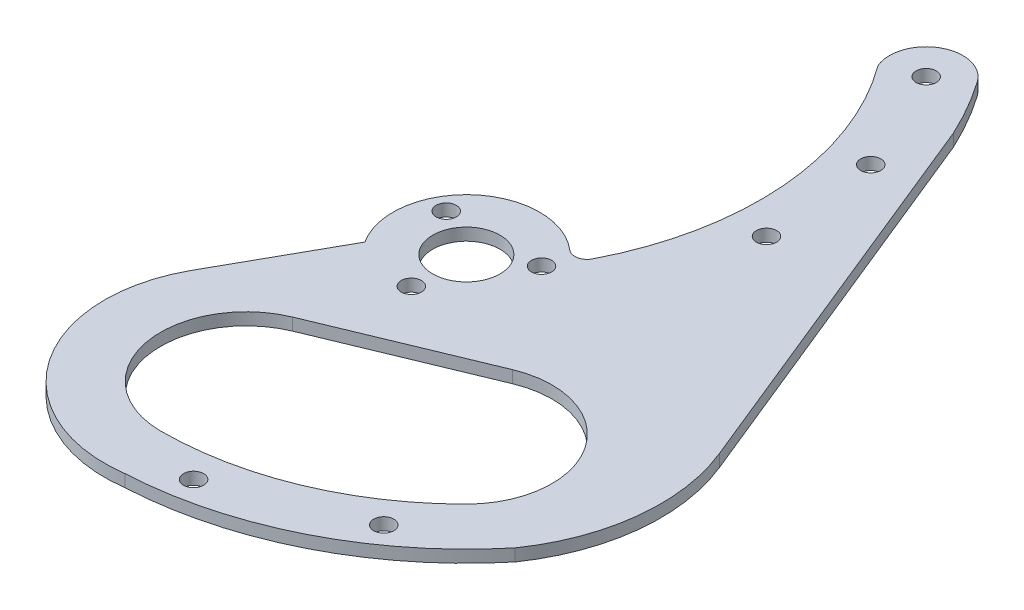
from build123d import *

# Parameters (mm, degrees)
SKETCH_1_R          = 1.65
SKETCH_1_R_2        = 5.5
EXTRUDE_1_DEPTH     = 2
SKETCH_2_R          = 1.65
CUT_EXTRUDE_1_DEPTH = 86.784644099
FILLET_1_R          = 2


with BuildPart() as part:
    # Эскиз1 → Бобышка-Вытянуть1 (new body)
    with BuildSketch(Plane(origin=(0, 0, 0), x_dir=(1, 0, 0), z_dir=(0, 1, 0))):
        with BuildLine():
            Line((22.63058135, 57.022094922), (48.869113703, -7.475462073))
            ThreePointArc((48.869113703, -7.475462073), (51.017863934, -22.940417651), (45.538728547, -37.5609872))
            ThreePointArc((45.538728547, -37.5609872), (26.585605536, -52.704925153), (3.142096023, -58.946847156))
            ThreePointArc((3.142096023, -58.946847156), (-19.13330087, -49.051718647), (-20.218209383, -24.701567755))
            Line((-20.218209383, -24.701567755), (-10.065450366, -6.533506633))
            ThreePointArc((-10.065450366, -6.533506633), (-6.891228037, 9.824000007), (9.569842381, 7.24003569))
            ThreePointArc((9.569842381, 7.24003569), (16.257964509, 34.227304723), (6.907279065, 60.411428714))
            ThreePointArc((6.907279065, 60.411428714), (9.487905153, 68.030832797), (17.329317504, 66.234391334))
            ThreePointArc((17.329317504, 66.234391334), (20.184340604, 61.745861093), (22.63058135, 57.022094922))
        make_face()
        with Locations(Location((9.550649772, -54.164426416, 0), (0, 0, 270))):
            Circle(SKETCH_1_R, mode=Mode.SUBTRACT)
        with Locations(Location((31.546703999, -45.053362436, 0), (0, 0, 90))):
            Circle(SKETCH_1_R, mode=Mode.SUBTRACT)
        with Locations(Location((0, 0, 0), (0, 0, 270))):
            Circle(SKETCH_1_R_2, mode=Mode.SUBTRACT)
        with Locations(Location((0, -9, 0), (0, 0, 270))):
            Circle(SKETCH_1_R, mode=Mode.SUBTRACT)
        with Locations(Location((-7.794228634, 4.5, 0), (0, 0, 270))):
            Circle(SKETCH_1_R, mode=Mode.SUBTRACT)
        with Locations(Location((7.794228634, 4.5, 0), (0, 0, 270))):
            Circle(SKETCH_1_R, mode=Mode.SUBTRACT)
        with BuildLine():
            Line((-5.357568053, -23.065686545), (20.09827607, -12.521530668))
            ThreePointArc((20.09827607, -12.521530668), (37.096418695, -17.67786086), (35.355339059, -35.355339059))
            ThreePointArc((35.355339059, -35.355339059), (19.134171618, -46.193976626), (0, -50))
            ThreePointArc((0, -50), (-13.730993926, -38.731264508), (-5.357568053, -23.065686545))
        make_face(mode=Mode.SUBTRACT)
    extrude(amount=EXTRUDE_1_DEPTH)

    # Эскиз2 → Вырез-Вытянуть1 (cut, through all)
    with BuildSketch(Plane.XZ):
        with Locations(Location((21.974708544, -27.113395045, 0), (0, 0, 270))):
            Circle(SKETCH_2_R)
        with Locations(Location((12.414405238, -62.792932716, 0), (0, 0, 270))):
            Circle(SKETCH_2_R)
        with Locations(Location((20.340189466, -45.796033589, 0), (0, 0, 270))):
            Circle(SKETCH_2_R)
    extrude(amount=-CUT_EXTRUDE_1_DEPTH, mode=Mode.SUBTRACT)

    # Скругление1
    fillet_1_edges = [part.edges().sort_by_distance(p)[0] for p in [
        (9.569842381, 1, -7.24003569),
    ]]
    fillet(fillet_1_edges, radius=FILLET_1_R)


solid = part.part
